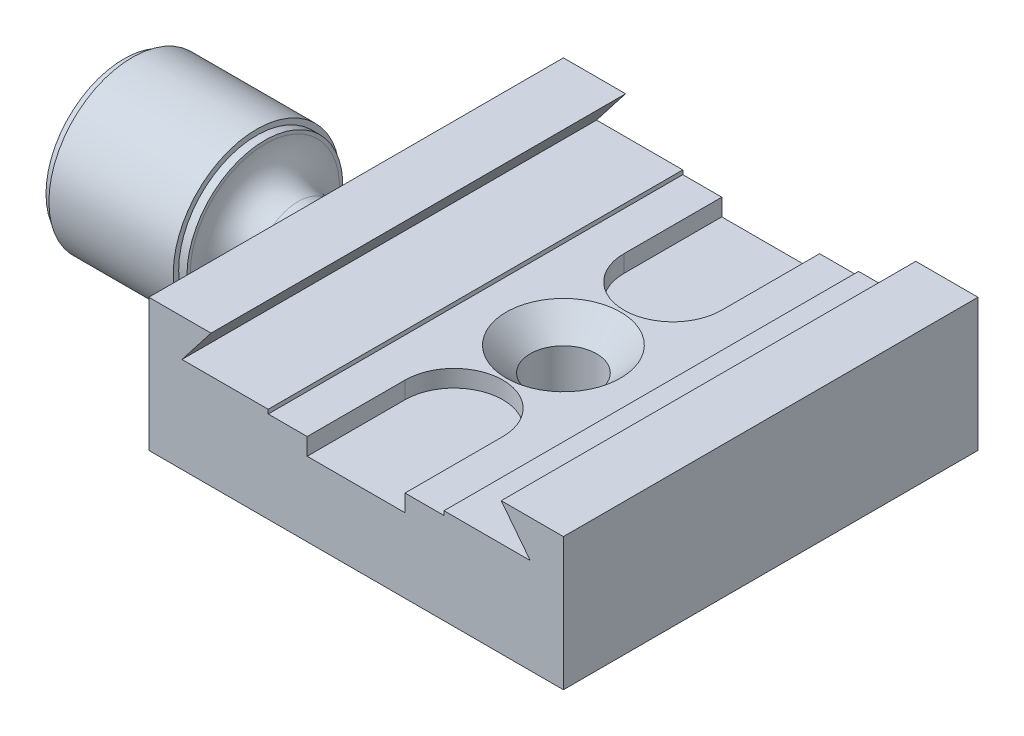
from build123d import *

# Parameters (mm, degrees)
SKETCH_1_R          = 5.9
EXTRUDE_1_DEPTH     = 8.94
SKETCH_1_4_R        = 4
EXTRUDE_2_DEPTH     = 11
SKETCH_1_5_W        = 14.4
SKETCH_1_5_H        = 50
EXTRUDE_3_DEPTH     = 16
CUT_EXTRUDE_1_DEPTH = 59.14636704
SKETCH_4_R          = 5
EXTRUDE_4_DEPTH     = 11
SKETCH_5_R          = 9.4
EXTRUDE_5_DEPTH     = 1
SKETCH_6_R          = 10.05
EXTRUDE_6_DEPTH     = 15
SKETCH_7_R          = 9.4
EXTRUDE_7_DEPTH     = 1
FILLET_1_R          = 4
CUT_EXTRUDE_3_DEPTH = 1.8
CUT_EXTRUDE_4_DEPTH = 2.8


with BuildPart() as part:
    # 草图1 → 凸台-拉伸1 (new body)
    with BuildSketch(Plane(origin=(0, 0, 0), x_dir=(1, 0, 0), z_dir=(0, 1, 0))):
        with BuildLine():
            Line((-5.9, -13.2), (-5.9, -25))
            Line((-5.9, -25), (5.9, -25))
            Line((5.9, -25), (5.9, -13.2))
            ThreePointArc((5.9, -13.2), (0, -19.1), (-5.9, -13.2))
        make_face()
        with Locations((0, -13.2)):
            Circle(SKETCH_1_R)
        with Locations((0, 13.2)):
            Circle(SKETCH_1_R)
        with BuildLine():
            Line((-5.9, 25), (-5.9, 13.2))
            ThreePointArc((-5.9, 13.2), (0, 19.1), (5.9, 13.2))
            Line((5.9, 13.2), (5.9, 25))
            Line((5.9, 25), (-5.9, 25))
        make_face()
    extrude(amount=EXTRUDE_1_DEPTH)

    # 草图1<4> → 凸台-拉伸2 (add)
    with BuildSketch(Plane(origin=(0, 0, 0), x_dir=(1, 0, 0), z_dir=(0, 1, 0))):
        with BuildLine():
            ThreePointArc((5.9, 13.2), (0, 7.3), (-5.9, 13.2))
            Line((-5.9, 13.2), (-5.9, 25))
            Line((-5.9, 25), (-10.6, 25))
            Line((-10.6, 25), (-10.6, -25))
            Line((-10.6, -25), (-5.9, -25))
            Line((-5.9, -25), (-5.9, -13.2))
            ThreePointArc((-5.9, -13.2), (0, -7.3), (5.9, -13.2))
            Line((5.9, -13.2), (5.9, -25))
            Line((5.9, -25), (10.6, -25))
            Line((10.6, -25), (10.6, 25))
            Line((10.6, 25), (5.9, 25))
            Line((5.9, 25), (5.9, 13.2))
        make_face()
        with Locations(Location((0, 0, 0), (0, 0, 270))):
            Circle(SKETCH_1_4_R, mode=Mode.SUBTRACT)
    extrude(amount=EXTRUDE_2_DEPTH)

    # 草图1<5> → 凸台-拉伸3 (add)
    with BuildSketch(Plane(origin=(0, 0, 0), x_dir=(1, 0, 0), z_dir=(0, 1, 0))):
        with Locations((17.8, 0)):
            Rectangle(SKETCH_1_5_W, SKETCH_1_5_H)
        with Locations((-17.8, 0)):
            Rectangle(SKETCH_1_5_W, SKETCH_1_5_H)
    extrude(amount=EXTRUDE_3_DEPTH)

    # 草图2 → 切除-拉伸1 (cut, through all)
    with BuildSketch(Plane.XY.offset(25)):
        Polygon((-17.5, 16), (-21, 11.5), (21, 11.5), (17.5, 16), align=None)
    extrude(amount=-CUT_EXTRUDE_1_DEPTH, mode=Mode.SUBTRACT)

    # 切除-拉伸2 cone 1 section (through the dimple's axis) → 切除-拉伸2 (revolve, cut)
    with BuildSketch(Plane(origin=(0, 11, 0), x_dir=(0, 0, 1), z_dir=(1, 0, 0))):
        Polygon((0, 0), (6.9, 0), (0, 6.9), align=None)
    revolve(axis=Axis((0, 11, 0), (0, -1, 0)), mode=Mode.SUBTRACT)

    # 草图4 → 凸台-拉伸4 (add)
    with BuildSketch(Plane.ZY.offset(25)):
        with Locations(Location((0, 5, 0), (0, 0, 270))):
            Circle(SKETCH_4_R)
    extrude(amount=EXTRUDE_4_DEPTH)

    # 草图5 → 凸台-拉伸5 (add)
    with BuildSketch(Plane.ZY.offset(36)):
        with Locations((0, 5)):
            Circle(SKETCH_5_R)
    extrude(amount=EXTRUDE_5_DEPTH)

    # 草图6 → 凸台-拉伸6 (add)
    with BuildSketch(Plane.ZY.offset(37)):
        with Locations((0, 5)):
            Circle(SKETCH_6_R)
    extrude(amount=EXTRUDE_6_DEPTH)

    # 草图7 → 凸台-拉伸7 (add)
    with BuildSketch(Plane.ZY.offset(52)):
        with Locations((0, 5)):
            Circle(SKETCH_7_R)
    extrude(amount=EXTRUDE_7_DEPTH)

    # 圆角1
    fillet_1_edges = [part.edges().sort_by_distance(p)[0] for p in [
        (-36, 10, 0),
    ]]
    fillet(fillet_1_edges, radius=FILLET_1_R)

    # 草图8 → 切除-拉伸3 (cut)
    with BuildSketch(Plane.XZ):
        with BuildLine():
            Line((-2.5, 3.122498999), (-2.5, 6.538348415))
            ThreePointArc((-2.5, 6.538348415), (-7, 0), (-2.5, -6.538348415))
            Line((-2.5, -6.538348415), (-2.5, -3.122498999))
            ThreePointArc((-2.5, -3.122498999), (-4, 0), (-2.5, 3.122498999))
        make_face()
        with BuildLine():
            ThreePointArc((7, 0), (5.766281297, 3.968626967), (2.5, 6.538348415))
            Line((2.5, 6.538348415), (2.5, 3.122498999))
            ThreePointArc((2.5, 3.122498999), (3.605551275, 1.732050808), (4, 0))
            ThreePointArc((4, 0), (3.605551275, -1.732050808), (2.5, -3.122498999))
            Line((2.5, -3.122498999), (2.5, -6.538348415))
            ThreePointArc((2.5, -6.538348415), (5.766281297, -3.968626967), (7, 0))
        make_face()
    extrude(amount=-CUT_EXTRUDE_3_DEPTH, mode=Mode.SUBTRACT)

    # 草图8<3> → 切除-拉伸4 (cut)
    with BuildSketch(Plane.XZ):
        with BuildLine():
            Line((2.5, 7.9), (2.5, -7.9))
            ThreePointArc((2.5, -7.9), (0, -10.4), (-2.5, -7.9))
            Line((-2.5, -7.9), (-2.5, 7.9))
            ThreePointArc((-2.5, 7.9), (0, 10.4), (2.5, 7.9))
        make_face()
    extrude(amount=-CUT_EXTRUDE_4_DEPTH, mode=Mode.SUBTRACT)


solid = part.part
